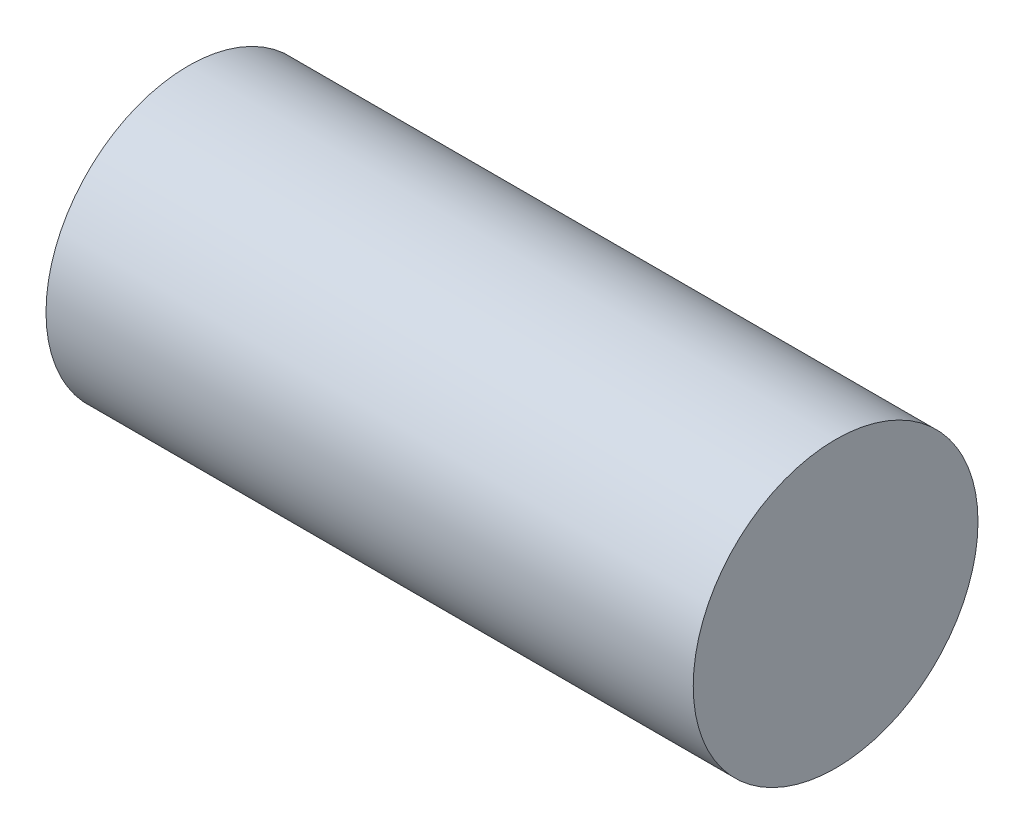
from build123d import *

# Parameters (mm, degrees)
SKETCH1_R           = 11
BOSS_EXTRUDE1_DEPTH = 50


with BuildPart() as part:
    # Sketch1 → Boss-Extrude1 (new body)
    with BuildSketch(Plane(origin=(0, 0, 0), x_dir=(0, 0, -1), z_dir=(1, 0, 0))):
        Circle(SKETCH1_R)
    extrude(amount=BOSS_EXTRUDE1_DEPTH)


solid = part.part
